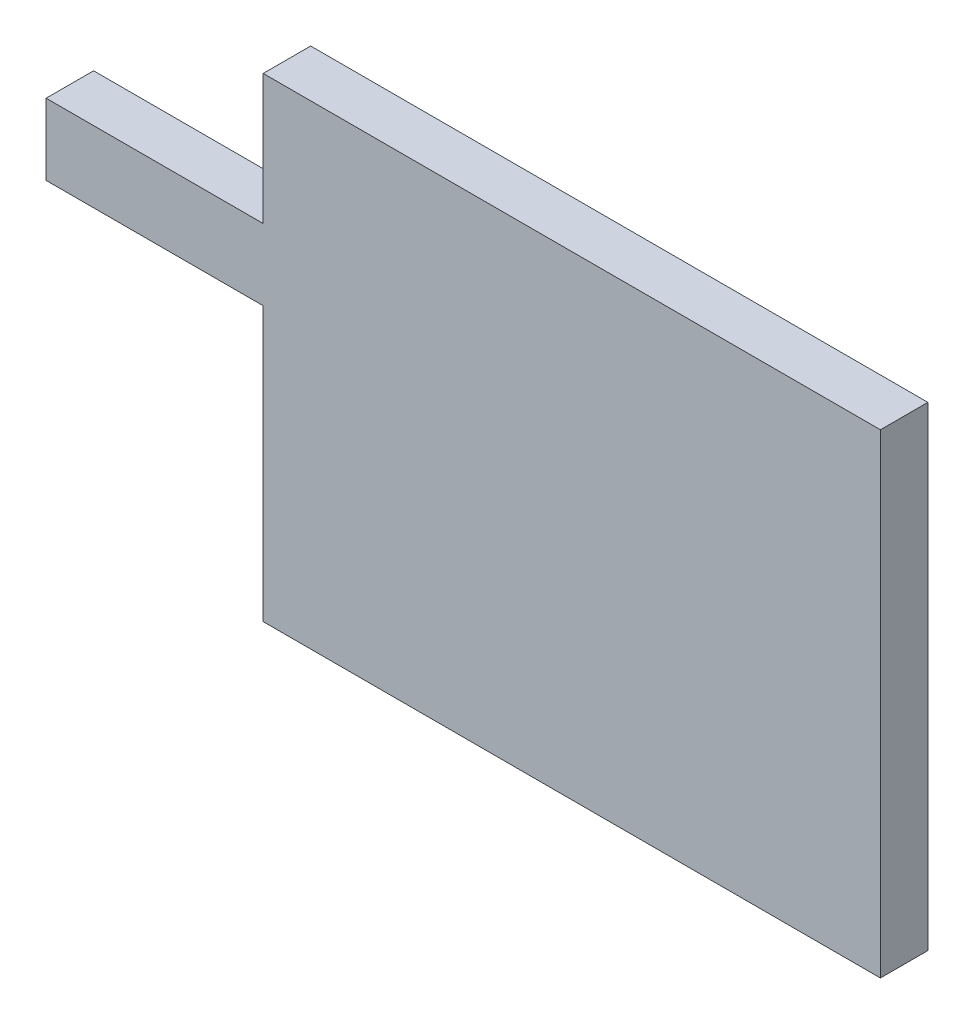
from build123d import *

# Parameters (mm, degrees)
BOSS_EXTRUDE1_DEPTH = 10


with BuildPart() as part:
    # Sketch1 → Boss-Extrude1 (new body)
    with BuildSketch(Plane.XY):
        Polygon((-105.501188117, 45.119560873), (24.498811883, 45.119560873), (24.498811883, -54.880439127), (-105.501188117, -54.880439127), (-105.501188117, 2.739560873), (-151.221188117, 2.739560873), (-151.221188117, 17.739560873), (-105.501188117, 17.739560873), align=None)
    extrude(amount=BOSS_EXTRUDE1_DEPTH)


solid = part.part
